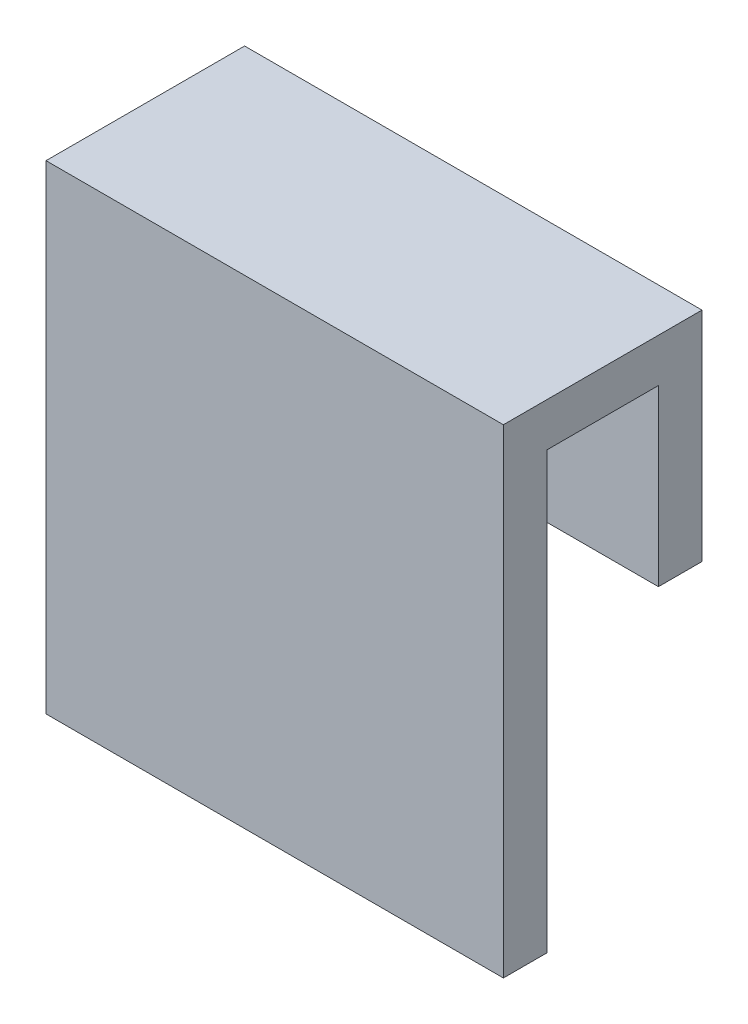
from build123d import *

# Parameters (mm, degrees)
BOSS_EXTRUDE1_DEPTH = 53.34


with BuildPart() as part:
    # Sketch1 → Boss-Extrude1 (new body)
    with BuildSketch(Plane(origin=(0, 0, 0), x_dir=(0, 0, -1), z_dir=(1, 0, 0))):
        Polygon((6.625440068, 45.409947125), (6.625440068, 25.089947125), (11.705440068, 25.089947125), (11.705440068, 50.489947125), (-11.454559932, 50.489947125), (-11.454559932, -5.390052875), (-6.374559932, -5.390052875), (-6.374559932, 45.409947125), align=None)
    extrude(amount=BOSS_EXTRUDE1_DEPTH)


solid = part.part
